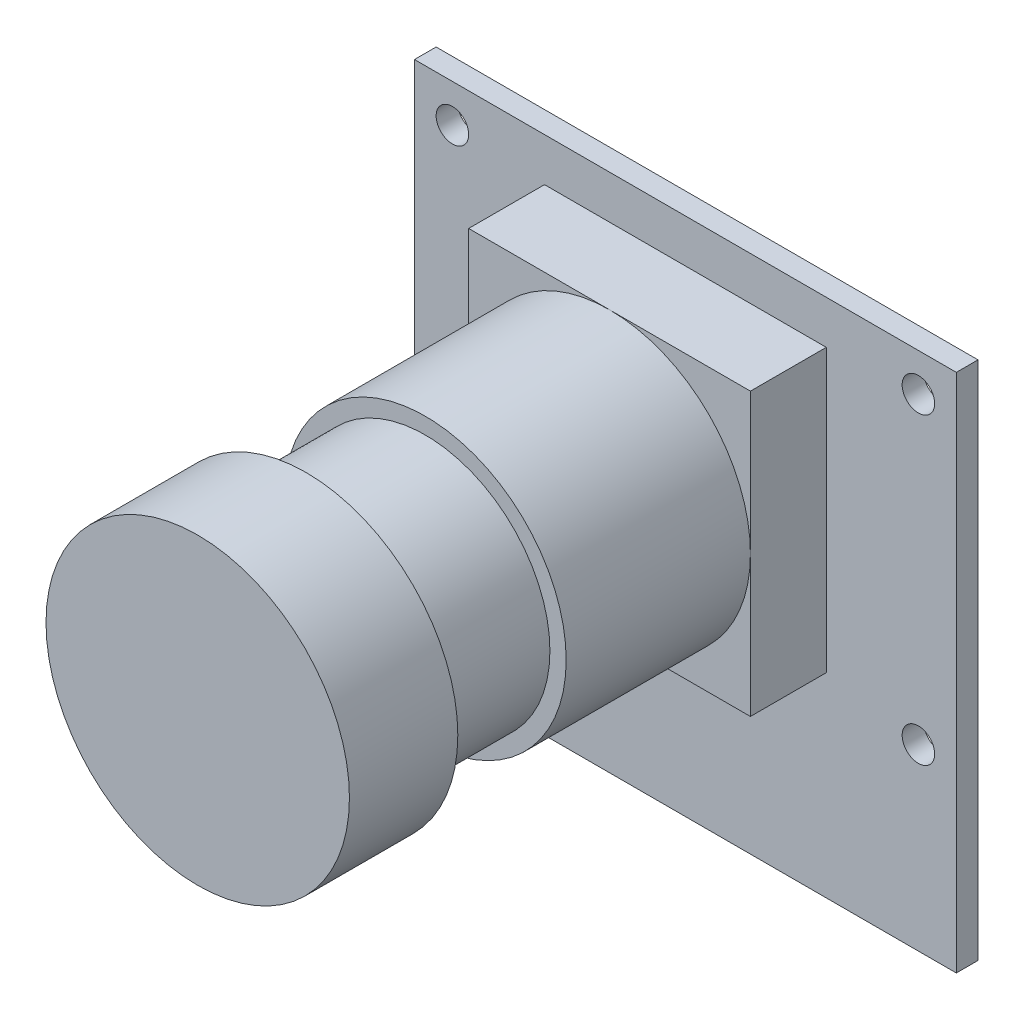
from build123d import *

# Parameters (mm, degrees)
SKETCH_1_W          = 25
SKETCH_1_H          = 24
EXTRUDE_1_DEPTH     = 1
SKETCH_2_W          = 13
SKETCH_2_H          = 13
EXTRUDE_2_DEPTH     = 3.5
SKETCH_3_R          = 6.5
EXTRUDE_3_DEPTH     = 8.5
SKETCH_4_R          = 5.75
EXTRUDE_4_DEPTH     = 5.5
SKETCH_5_R          = 7
EXTRUDE_5_DEPTH     = 5
SKETCH_6_R          = 0.75
CUT_EXTRUDE_1_DEPTH = 1
SKETCH_7_W          = 14.3
SKETCH_7_H          = 5.5
EXTRUDE_6_DEPTH     = 2


with BuildPart() as part:
    # 草图1 → 凸台-拉伸1 (new body)
    with BuildSketch(Plane.XY):
        Rectangle(SKETCH_1_W, SKETCH_1_H)
    extrude(amount=EXTRUDE_1_DEPTH)

    # 草图2 → 凸台-拉伸2 (add)
    with BuildSketch(Plane.XY.offset(1)):
        with Locations((0, 3.5)):
            Rectangle(SKETCH_2_W, SKETCH_2_H)
    extrude(amount=EXTRUDE_2_DEPTH)

    # 草图3 → 凸台-拉伸3 (add)
    with BuildSketch(Plane.XY.offset(4.5)):
        with Locations((0, 3.5)):
            Circle(SKETCH_3_R)
    extrude(amount=EXTRUDE_3_DEPTH)

    # 草图4 → 凸台-拉伸4 (add)
    with BuildSketch(Plane.XY.offset(13)):
        with Locations((0, 3.5)):
            Circle(SKETCH_4_R)
    extrude(amount=EXTRUDE_4_DEPTH)

    # 草图5 → 凸台-拉伸5 (add)
    with BuildSketch(Plane.XY.offset(18.5)):
        with Locations((0, 3.5)):
            Circle(SKETCH_5_R)
    extrude(amount=EXTRUDE_5_DEPTH)

    # 草图6 → 切除-拉伸1 (cut)
    with BuildSketch(Plane.XY.offset(1)):
        with Locations((10.75, 10.25)):
            Circle(SKETCH_6_R)
        with Locations((10.75, -3.75)):
            Circle(SKETCH_6_R)
        with Locations((-10.75, 10.25)):
            Circle(SKETCH_6_R)
        with Locations((-10.75, -3.75)):
            Circle(SKETCH_6_R)
    extrude(amount=-CUT_EXTRUDE_1_DEPTH, mode=Mode.SUBTRACT)

    # 草图7 → 凸台-拉伸6 (add)
    with BuildSketch(Plane(origin=(0, 0, 0), x_dir=(-1, 0, 0), z_dir=(0, 0, -1))):
        with Locations((0, -9.25)):
            Rectangle(SKETCH_7_W, SKETCH_7_H)
    extrude(amount=EXTRUDE_6_DEPTH)


solid = part.part
